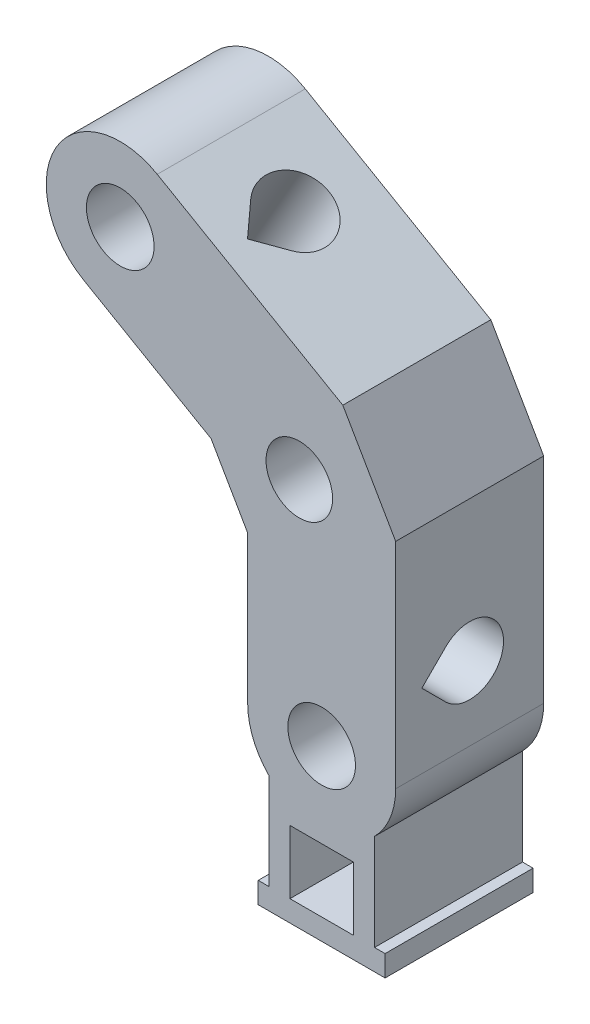
from build123d import *

# Parameters (mm, degrees)
SKETCH1_W           = 6
SKETCH1_H           = 6
BOSS_EXTRUDE1_DEPTH = 14
HOLE2_D             = 6.4
HOLE1_D             = 6.4
CUT_EXTRUDE2_DEPTH  = 47.465040622
CUT_EXTRUDE1_DEPTH  = 46.814563472
SKETCH8_R           = 3.15
CUT_EXTRUDE3_DEPTH  = 50.746716719


with BuildPart() as part:
    # Sketch1 → Boss-Extrude1 (new body)
    with BuildSketch(Plane.XY.offset(14)):
        with BuildLine():
            Line((7, 0), (7, 20.267949192))
            Line((7, 20.267949192), (2, 28.92820323))
            Line((2, 28.92820323), (-15.552558883, 39.062177826))
            ThreePointArc((-15.552558883, 39.062177826), (-25.11473671, 36.5), (-22.552558883, 26.937822174))
            Line((-22.552558883, 26.937822174), (-10.464101615, 19.958548116))
            Line((-10.464101615, 19.958548116), (-7, 13.958548116))
            Line((-7, 13.958548116), (-7, 0))
            ThreePointArc((-7, 0), (-6.480740698, -2.645751311), (-5, -4.898979486))
            Line((-5, -4.898979486), (-5, -14))
            Line((-5, -14), (-6, -14))
            Line((-6, -14), (-6, -16))
            Line((-6, -16), (6, -16))
            Line((6, -16), (6, -14))
            Line((6, -14), (5, -14))
            Line((5, -14), (5, -4.898979486))
            ThreePointArc((5, -4.898979486), (6.480740698, -2.645751311), (7, 0))
        make_face()
        with Locations((0, -11)):
            Rectangle(SKETCH1_W, SKETCH1_H, mode=Mode.SUBTRACT)
    extrude(amount=-BOSS_EXTRUDE1_DEPTH)

    # Hole2 (through all)
    with Locations(Plane(origin=(0, 0, 0), x_dir=(-1, 0, 0), z_dir=(0, 0, -1))):
        with Locations((19.0525, 32.999898011)):
            Hole(HOLE2_D / 2)

    # Hole1 (through all)
    with Locations(Plane(origin=(0, 0, 0), x_dir=(-1, 0, 0), z_dir=(0, 0, -1))):
        with Locations((0, 0)):
            Hole(HOLE1_D / 2)

    # Sketch3 → Cut-Extrude2 (cut, through all)
    with BuildSketch(Plane.ZY.offset(7)):
        with BuildLine():
            Line((9.2627417, 4.7372583), (11.5254834, 7))
            Line((11.5254834, 7), (9.2627417, 9.2627417))
            ThreePointArc((9.2627417, 9.2627417), (3.8, 7), (9.2627417, 4.7372583))
        make_face()
    extrude(amount=-CUT_EXTRUDE2_DEPTH, mode=Mode.SUBTRACT)

    # Sketch2 → Cut-Extrude1 (cut, through all)
    with BuildSketch(Plane(origin=(6.026279442, 10.437822174, 0), x_dir=(0.8660254037844398, -0.49999999999999806, 0), z_dir=(-0.499999999999998, -0.8660254037844397, 0))):
        with BuildLine():
            Line((-25.999898011, 11.5254834), (-28.262639711, 9.2627417))
            ThreePointArc((-28.262639711, 9.2627417), (-25.999898011, 3.8), (-23.737156311, 9.2627417))
            Line((-23.737156311, 9.2627417), (-25.999898011, 11.5254834))
        make_face()
    extrude(amount=-CUT_EXTRUDE1_DEPTH, mode=Mode.SUBTRACT)

    # Sketch8 → Cut-Extrude3 (cut, through all)
    with BuildSketch(Plane.XY.offset(14)):
        with Locations((-2.116025404, 20.778312164)):
            Circle(SKETCH8_R)
    extrude(amount=-CUT_EXTRUDE3_DEPTH, mode=Mode.SUBTRACT)


solid = part.part
